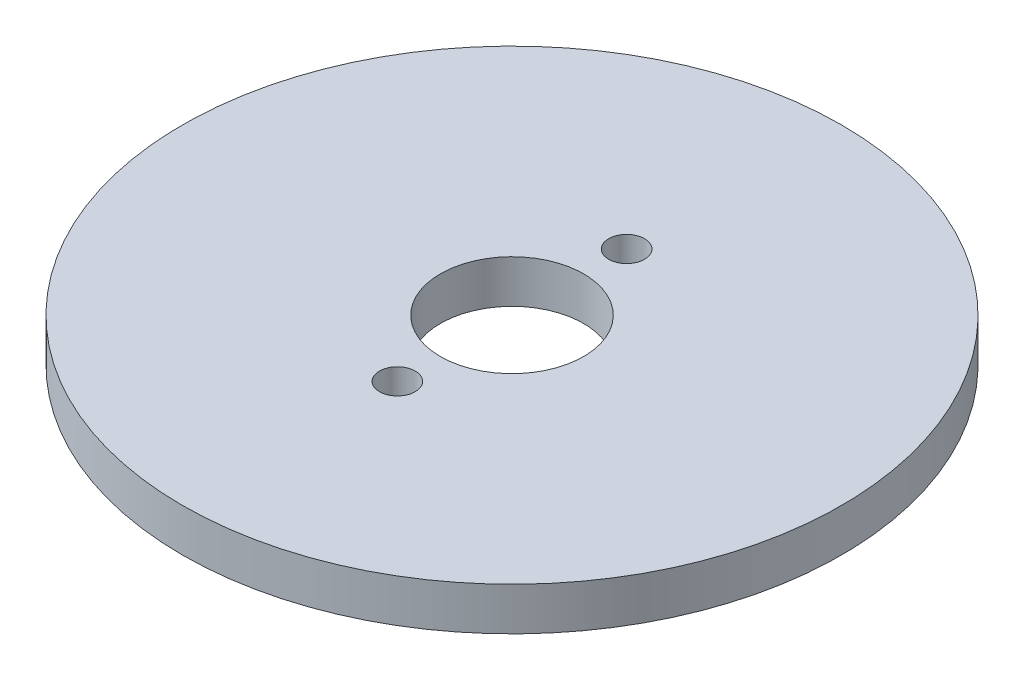
from build123d import *

# Parameters (mm, degrees)
SKETCH1_R           = 23
BOSS_EXTRUDE1_DEPTH = 3
SKETCH2_R           = 5
CUT_EXTRUDE1_DEPTH  = 33.664965942
SKETCH3_R           = 1.25
CUT_EXTRUDE2_DEPTH  = 33.664965942


with BuildPart() as part:
    # Sketch1 → Boss-Extrude1 (new body)
    with BuildSketch(Plane(origin=(0, 0, 0), x_dir=(1, 0, 0), z_dir=(0, 1, 0))):
        with Locations(Location((0, 0, 0), (0, 0, 270))):
            Circle(SKETCH1_R)
    extrude(amount=BOSS_EXTRUDE1_DEPTH)

    # Sketch2 → Cut-Extrude1 (cut, through all)
    with BuildSketch(Plane(origin=(0, 3, 0), x_dir=(1, 0, 0), z_dir=(0, 1, 0))):
        with Locations(Location((0, 0, 0), (0, 0, 270))):
            Circle(SKETCH2_R)
    extrude(amount=-CUT_EXTRUDE1_DEPTH, mode=Mode.SUBTRACT)

    # Sketch3 → Cut-Extrude2 (cut, through all)
    with BuildSketch(Plane(origin=(0, 3, 0), x_dir=(1, 0, 0), z_dir=(0, 1, 0))):
        with Locations(Location((0, 8, 0), (0, 0, 270))):
            Circle(SKETCH3_R)
        with Locations(Location((0, -8, 0), (0, 0, 270))):
            Circle(SKETCH3_R)
    extrude(amount=-CUT_EXTRUDE2_DEPTH, mode=Mode.SUBTRACT)


solid = part.part
